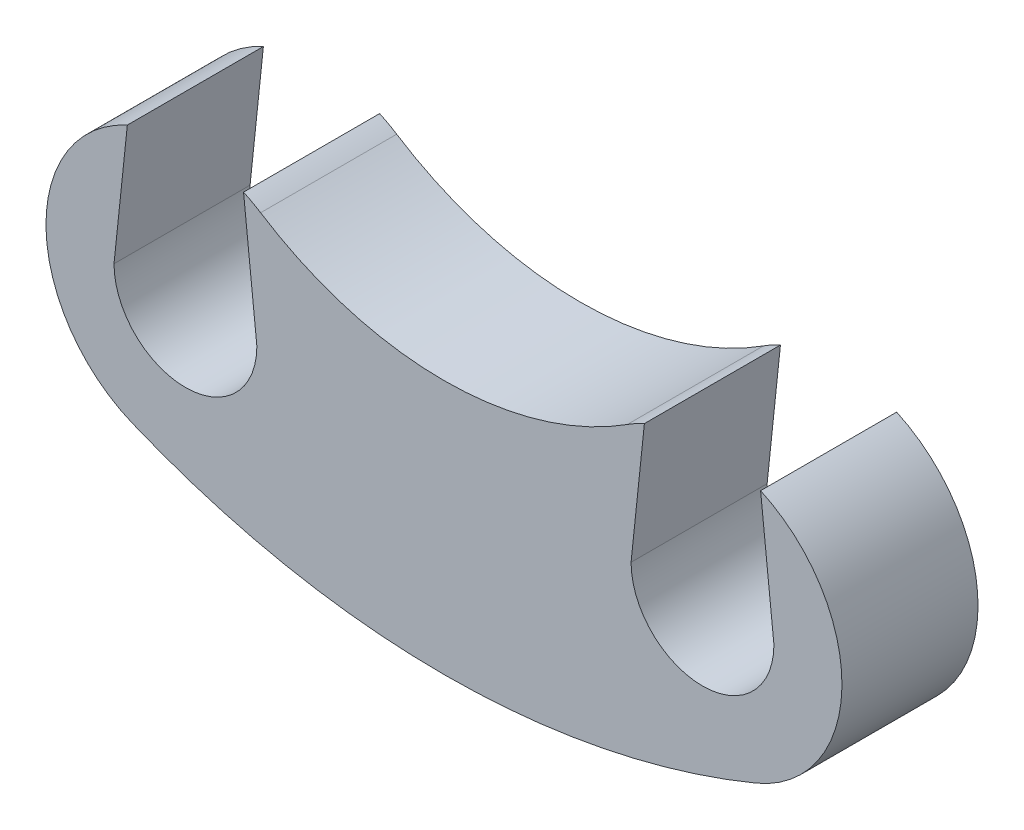
from build123d import *

# Parameters (mm, degrees)
BOSS_EXTRUDE1_DEPTH = 10


with BuildPart() as part:
    # Sketch1 → Boss-Extrude1 (new body)
    with BuildSketch(Plane.XY):
        with BuildLine():
            Line((-5.25, 0), (-4.270644538, 9.317944797))
            ThreePointArc((-4.270644538, 9.317944797), (-10.248160277, -0.194193027), (-3.914572864, -9.473046991))
            ThreePointArc((-3.914572864, -9.473046991), (19, -14.021064606), (41.914572864, -9.473046991))
            ThreePointArc((41.914572864, -9.473046991), (48.248160277, -0.194193027), (42.270644538, 9.317944797))
            Line((42.270644538, 9.317944797), (43.25, 0))
            ThreePointArc((43.25, 0), (38, -5.25), (32.75, 0))
            Line((32.75, 0), (33.729355462, 9.317944797))
            ThreePointArc((33.729355462, 9.317944797), (33.090327833, 8.997645204), (32.475177305, 8.633587562))
            ThreePointArc((32.475177305, 8.633587562), (19, 4.691118201), (5.524822695, 8.633587562))
            ThreePointArc((5.524822695, 8.633587562), (4.909672167, 8.997645204), (4.270644538, 9.317944797))
            Line((4.270644538, 9.317944797), (5.25, 0))
            ThreePointArc((5.25, 0), (0, -5.25), (-5.25, 0))
        make_face()
    extrude(amount=BOSS_EXTRUDE1_DEPTH)


solid = part.part
